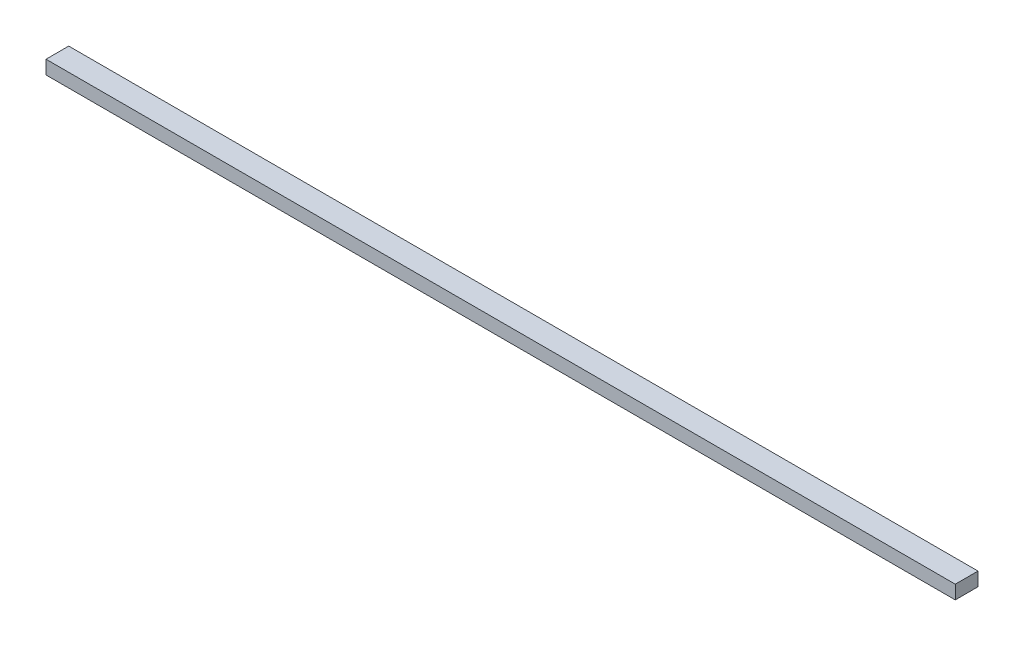
from build123d import *

# Parameters (mm, degrees)
SKETCH1_W           = 200
SKETCH1_H           = 5
BOSS_EXTRUDE1_DEPTH = 3


with BuildPart() as part:
    # Sketch1 → Boss-Extrude1 (new body)
    with BuildSketch(Plane(origin=(0, 0, 0), x_dir=(1, 0, 0), z_dir=(0, 1, 0))):
        with Locations((100, 2.5)):
            Rectangle(SKETCH1_W, SKETCH1_H)
    extrude(amount=BOSS_EXTRUDE1_DEPTH)


solid = part.part
